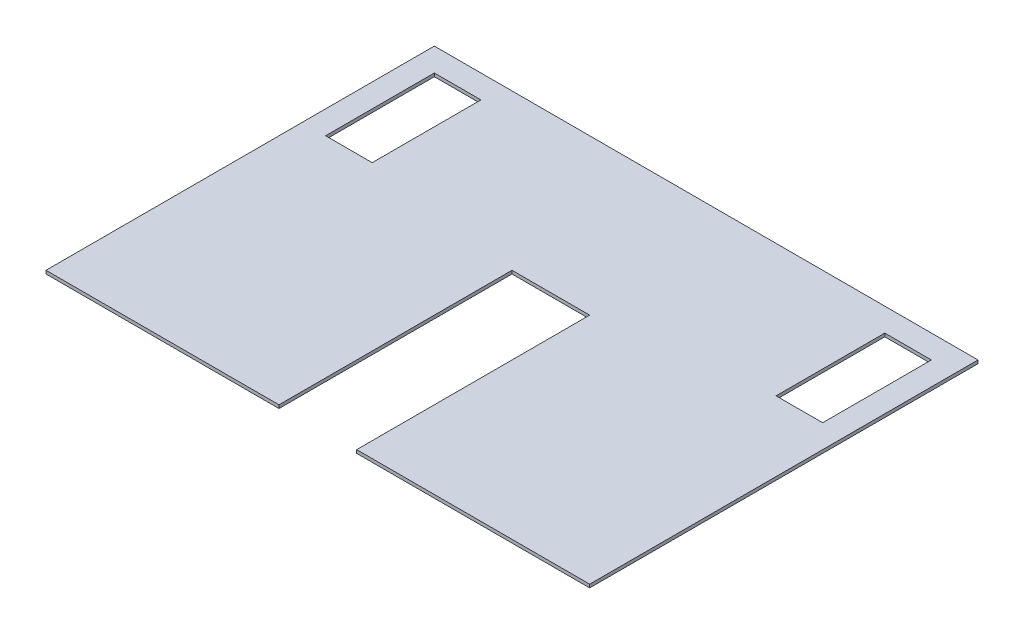
from build123d import *

# Parameters (mm, degrees)
SKETCH1_W           = 177.8
SKETCH1_H           = 127
BOSS_EXTRUDE1_DEPTH = 1.0668
SKETCH2_W           = 25.4
SKETCH2_H           = 76.2
SKETCH2_W_2         = 15.24
SKETCH2_H_2         = 35.56
CUT_EXTRUDE1_DEPTH  = 219.50166604


with BuildPart() as part:
    # Sketch1 → Boss-Extrude1 (new body)
    with BuildSketch(Plane(origin=(0, 0, 0), x_dir=(1, 0, 0), z_dir=(0, 1, 0))):
        with Locations((-88.9, 63.5)):
            Rectangle(SKETCH1_W, SKETCH1_H)
    extrude(amount=BOSS_EXTRUDE1_DEPTH)

    # Sketch2 → Cut-Extrude1 (cut, through all)
    with BuildSketch(Plane(origin=(0, 1.0668, 0), x_dir=(1, 0, 0), z_dir=(0, 1, 0))):
        with Locations((-88.9, 38.1)):
            Rectangle(SKETCH2_W, SKETCH2_H)
        with Locations((-162.56, 101.6)):
            Rectangle(SKETCH2_W_2, SKETCH2_H_2)
        with Locations((-15.24, 101.6)):
            Rectangle(SKETCH2_W_2, SKETCH2_H_2)
    extrude(amount=-CUT_EXTRUDE1_DEPTH, mode=Mode.SUBTRACT)


solid = part.part
